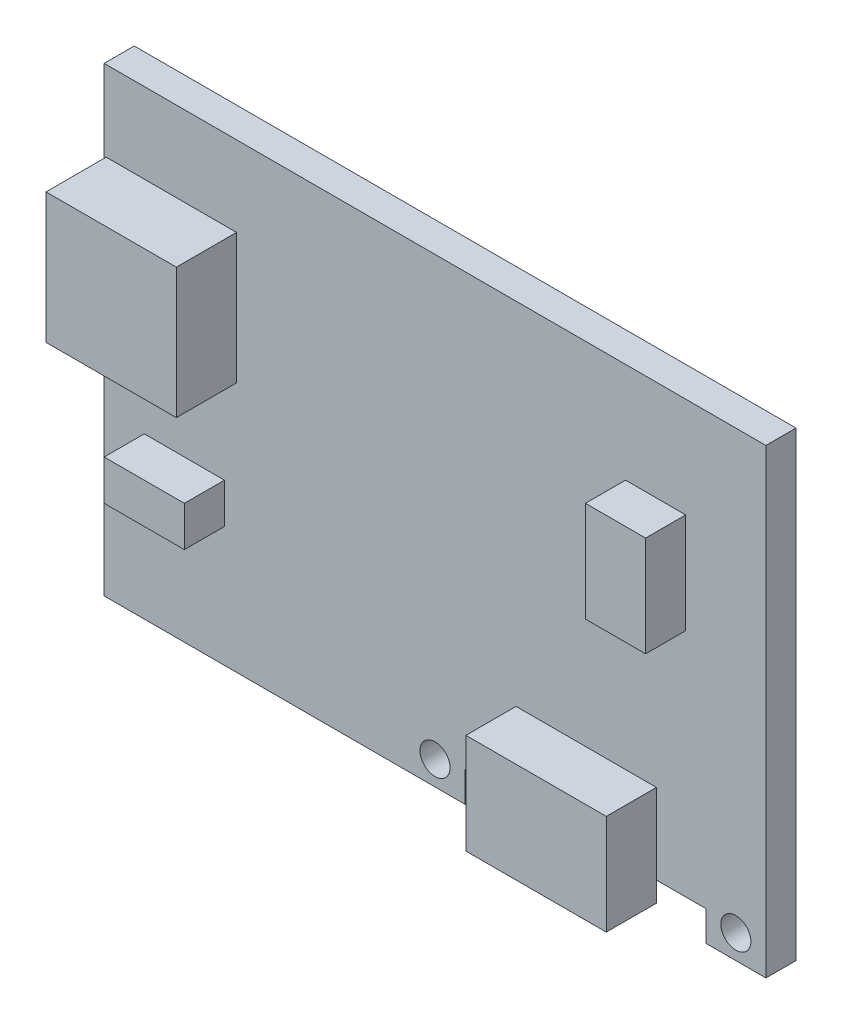
from build123d import *

# Parameters (mm, degrees)
SKETCH_1_W          = 33
SKETCH_1_H          = 23
EXTRUDE_1_DEPTH     = 1.5
SKETCH_2_W          = 12
SKETCH_2_H          = 1.5
CUT_EXTRUDE_1_DEPTH = 41.252329125
SKETCH_3_R          = 0.75
CUT_EXTRUDE_2_DEPTH = 41.252329125
SKETCH_4_W          = 4
SKETCH_4_H          = 2
EXTRUDE_2_DEPTH     = 2
SKETCH_5_W          = 3
SKETCH_5_H          = 5
EXTRUDE_3_DEPTH     = 2
SKETCH_6_W          = 6.5
SKETCH_6_H          = 6.5
EXTRUDE_4_DEPTH     = 3
SKETCH_7_W          = 7
SKETCH_7_H          = 5
EXTRUDE_5_DEPTH     = 2.5


with BuildPart() as part:
    # 草图1 → 凸台-拉伸1 (new body)
    with BuildSketch(Plane.XY):
        with Locations((16.5, 11.5)):
            Rectangle(SKETCH_1_W, SKETCH_1_H)
    extrude(amount=EXTRUDE_1_DEPTH)

    # 草图2 → 切除-拉伸1 (cut, through all)
    with BuildSketch(Plane.XY.offset(1.5)):
        with Locations((24, 0.75)):
            Rectangle(SKETCH_2_W, SKETCH_2_H)
    extrude(amount=-CUT_EXTRUDE_1_DEPTH, mode=Mode.SUBTRACT)

    # 草图3 → 切除-拉伸2 (cut, through all)
    with BuildSketch(Plane.XY.offset(1.5)):
        with Locations((31.5, 1.2)):
            Circle(SKETCH_3_R)
        with Locations((16.5, 1.2)):
            Circle(SKETCH_3_R)
    extrude(amount=-CUT_EXTRUDE_2_DEPTH, mode=Mode.SUBTRACT)

    # 草图4 → 凸台-拉伸2 (add)
    with BuildSketch(Plane.XY.offset(1.5)):
        with Locations((4, 7)):
            Rectangle(SKETCH_4_W, SKETCH_4_H)
    extrude(amount=EXTRUDE_2_DEPTH)

    # 草图5 → 凸台-拉伸3 (add)
    with BuildSketch(Plane.XY.offset(1.5)):
        with Locations((27.5, 15.5)):
            Rectangle(SKETCH_5_W, SKETCH_5_H)
    extrude(amount=EXTRUDE_3_DEPTH)

    # 草图6 → 凸台-拉伸4 (add)
    with BuildSketch(Plane.XY.offset(1.5)):
        with Locations((3.35, 15.75)):
            Rectangle(SKETCH_6_W, SKETCH_6_H)
    extrude(amount=EXTRUDE_4_DEPTH)

    # 草图7 → 凸台-拉伸5 (add)
    with BuildSketch(Plane.XY.offset(1.5)):
        with Locations((24.039083368, 3)):
            Rectangle(SKETCH_7_W, SKETCH_7_H)
    extrude(amount=EXTRUDE_5_DEPTH)


solid = part.part
